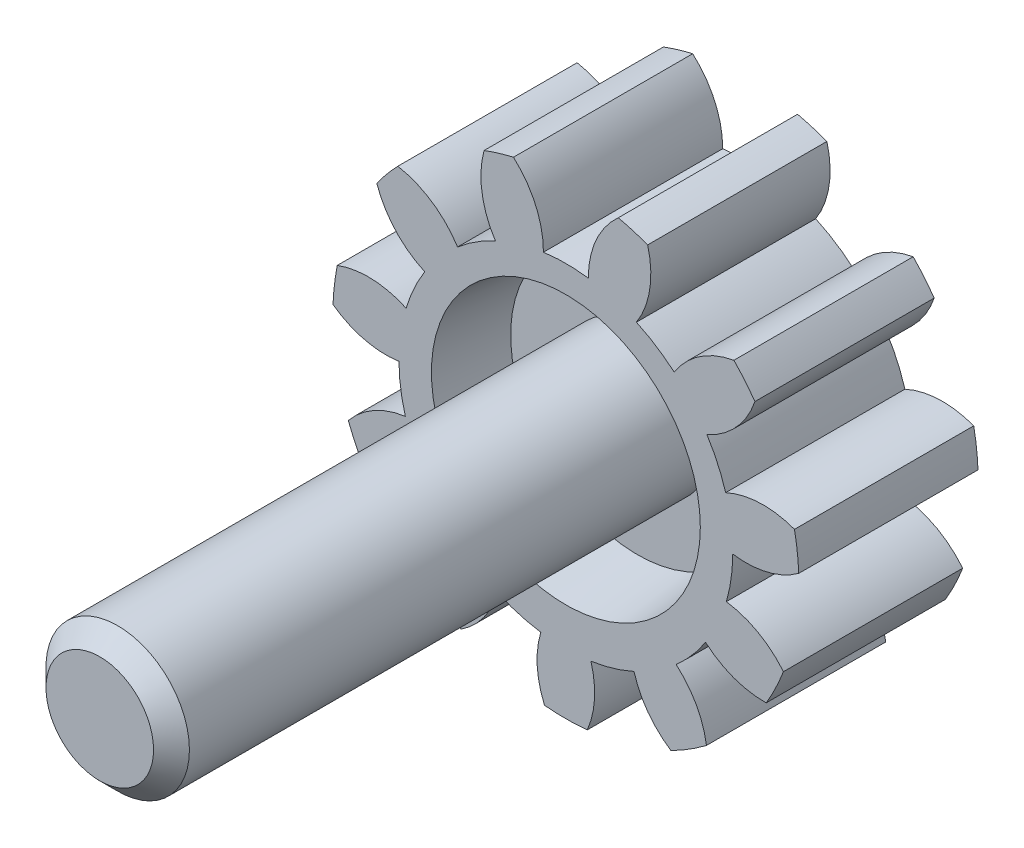
from build123d import *

# Parameters (mm, degrees)
SKETCH_3_R               = 13
EXTRUDE_1_DEPTH          = 10
CUT_EXTRUDE_1_DEPTH      = 21.928449536
PATTERN_CIRCULAR_1_COUNT = 11
SKETCH_5_R               = 7.5
CUT_EXTRUDE_2_DEPTH      = 4
CUT_EXTRUDE_2_DRAFT      = -6
SKETCH_6_R               = 7.5
CUT_EXTRUDE_3_DEPTH      = 4
CUT_EXTRUDE_3_DRAFT      = -6
SKETCH_8_R               = 4
EXTRUDE_3_DEPTH          = 30
CHAMFER_2_SIZE           = 1


with BuildPart() as part:
    # Эскиз3 → Бобышка-Вытянуть1 (new body)
    with BuildSketch(Plane.XY):
        Circle(SKETCH_3_R)
    extrude(amount=-EXTRUDE_1_DEPTH)

    # Эскиз4 → Вырез-Вытянуть1 (cut, through all)
    with BuildSketch(Plane.XY):
        with BuildLine():
            ThreePointArc((2.924363706, 12.666810842), (0, 13), (-2.924363706, 12.666810842))
            ThreePointArc((-2.924363706, 12.666810842), (-1.684886314, 10.969320472), (-1.252557909, 8.912412619))
            ThreePointArc((-1.252557909, 8.912412619), (0, 9), (1.252557909, 8.912412619))
            ThreePointArc((1.252557909, 8.912412619), (1.684886314, 10.969320472), (2.924363706, 12.666810842))
        make_face()
    cut_extrude_1 = extrude(amount=-CUT_EXTRUDE_1_DEPTH, mode=Mode.SUBTRACT)

    # Круговой массив1: Вырез-Вытянуть1 ×11 about axis
    pattern_circular_1_axis = Axis((0, -0.313541407, 0), (0, 0, 1))
    for i in range(1, PATTERN_CIRCULAR_1_COUNT):
        add(cut_extrude_1.rotate(pattern_circular_1_axis, i * 360 / PATTERN_CIRCULAR_1_COUNT), mode=Mode.SUBTRACT)


with BuildPart() as cut_extrude_2_tool:
    # Эскиз5 → Вырез-Вытянуть2 (with draft: the straight prism first)
    with BuildSketch(Plane.XY):
        Circle(SKETCH_5_R)
    extrude(amount=-CUT_EXTRUDE_2_DEPTH)
    # Вырез-Вытянуть2: the draft: its side faces are tilted about the plane it starts from
    cut_extrude_2_sides = [cut_extrude_2_tool.faces().sort_by_distance(p)[0] for p in [
        (-7.5, 0, -2),
    ]]
    draft(cut_extrude_2_sides, Plane.XY, CUT_EXTRUDE_2_DRAFT)


with BuildPart() as part_1:
    add(part.part)

    # Вырез-Вытянуть2: cut by cut_extrude_2_tool
    add(cut_extrude_2_tool.part, mode=Mode.SUBTRACT)


with BuildPart() as cut_extrude_3_tool:
    # Эскиз6 → Вырез-Вытянуть3 (with draft: the straight prism first)
    with BuildSketch(Plane(origin=(0, 0, -10), x_dir=(-1, 0, 0), z_dir=(0, 0, -1))):
        Circle(SKETCH_6_R)
    extrude(amount=-CUT_EXTRUDE_3_DEPTH)
    # Вырез-Вытянуть3: the draft: its side faces are tilted about the plane it starts from
    cut_extrude_3_sides = [cut_extrude_3_tool.faces().sort_by_distance(p)[0] for p in [
        (7.5, 0, -8),
    ]]
    draft(cut_extrude_3_sides, Plane(origin=(0, 0, -10), x_dir=(-1, 0, 0), z_dir=(0, 0, -1)), CUT_EXTRUDE_3_DRAFT)


with BuildPart() as part_2:
    add(part_1.part)

    # Вырез-Вытянуть3: cut by cut_extrude_3_tool
    add(cut_extrude_3_tool.part, mode=Mode.SUBTRACT)

    # Эскиз8 → Бобышка-Вытянуть3 (add)
    with BuildSketch(Plane.XY.offset(-4)):
        Circle(SKETCH_8_R)
    extrude(amount=EXTRUDE_3_DEPTH)

    # Фаска2
    chamfer_2_edges = [part_2.edges().sort_by_distance(p)[0] for p in [
        (-4, 0, 26),
    ]]
    chamfer(chamfer_2_edges, length=CHAMFER_2_SIZE)


solid = part_2.part
